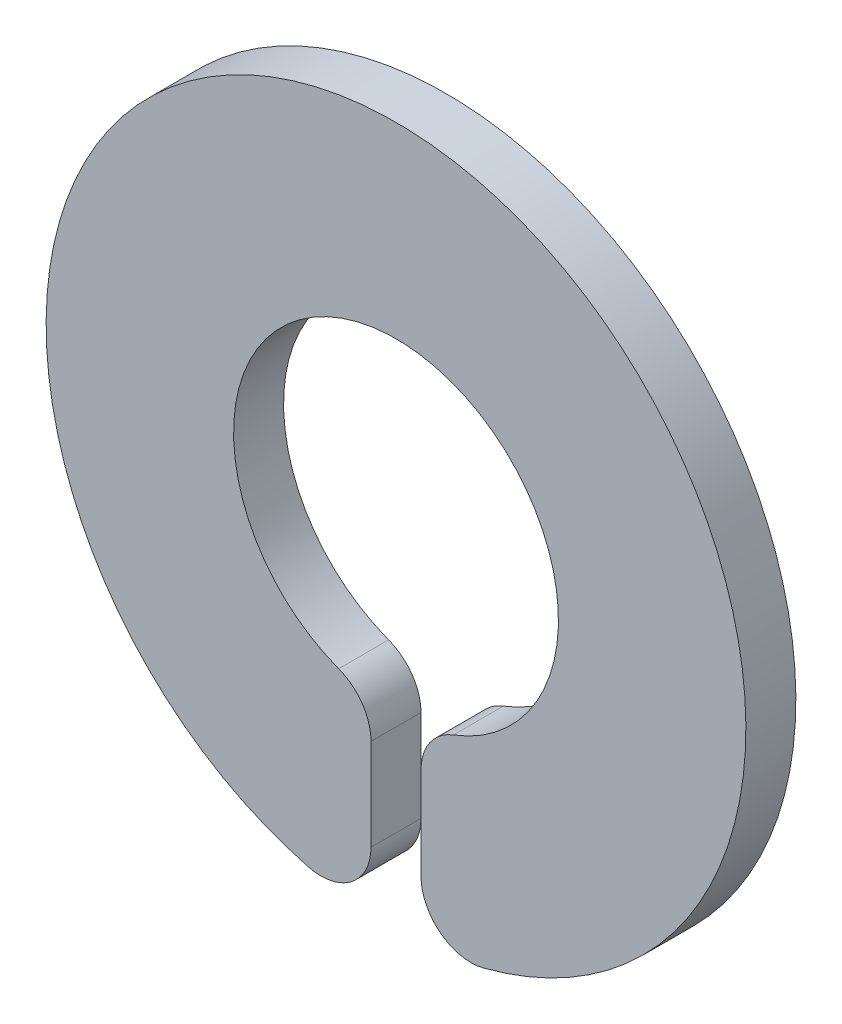
from build123d import *

# Parameters (mm, degrees)
P_IDAT_VYSUNUT_M1_DEPTH = 1
ZAOBLIT1_R              = 1


with BuildPart() as part:
    # Skica1 → Přidat vysunutím1 (new body)
    with BuildSketch(Plane.XY):
        with BuildLine():
            Line((-0.5, -3.211308145), (-0.5, -6.982120022))
            ThreePointArc((-0.5, -6.982120022), (0, 7), (0.5, -6.982120022))
            Line((0.5, -6.982120022), (0.5, -3.211308145))
            ThreePointArc((0.5, -3.211308145), (0, 3.25), (-0.5, -3.211308145))
        make_face()
    extrude(amount=P_IDAT_VYSUNUT_M1_DEPTH)

    # Zaoblit1
    zaoblit1_edges = [part.edges().sort_by_distance(p)[0] for p in [
        (-0.5, -3.211308145, 0.5),
        (-0.5, -6.982120022, 0.5),
        (0.5, -6.982120022, 0.5),
        (0.5, -3.211308145, 0.5),
    ]]
    fillet(zaoblit1_edges, radius=ZAOBLIT1_R)


solid = part.part
